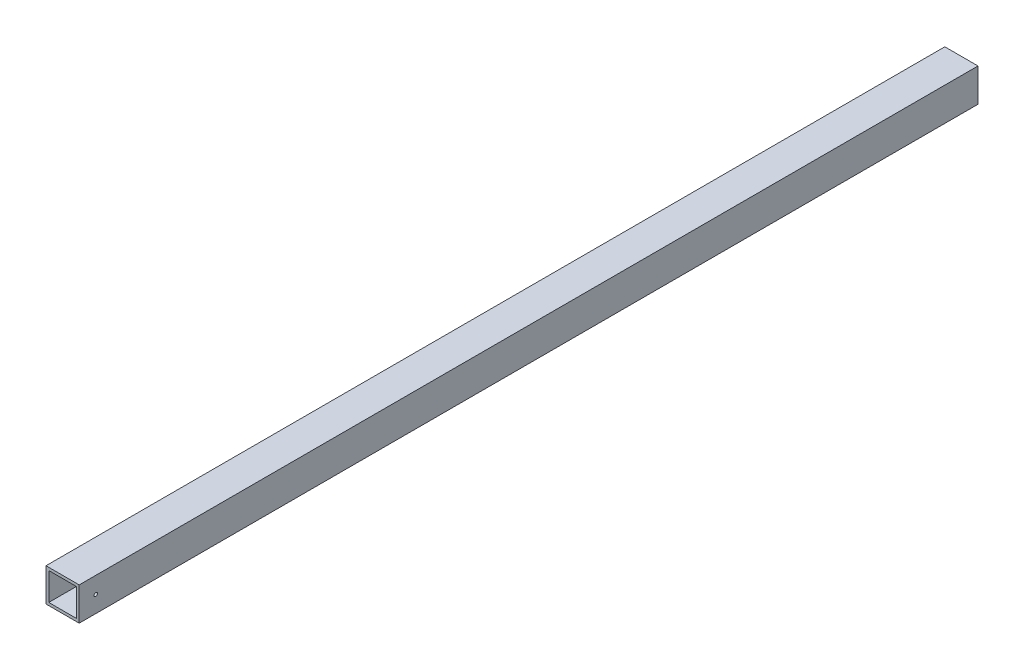
from build123d import *

# Parameters (mm, degrees)
SKETCH_1_W         = 24
SKETCH_1_H         = 24
SKETCH_1_W_2       = 20
SKETCH_1_H_2       = 20
EXTRUDE_1_DEPTH    = 650
HOLE_WIZARD_M3_2_D = 2.5


with BuildPart() as part:
    # 草图1 → 凸台-拉伸1 (new body)
    with BuildSketch(Plane.XY):
        Rectangle(SKETCH_1_W, SKETCH_1_H)
        Rectangle(SKETCH_1_W_2, SKETCH_1_H_2, mode=Mode.SUBTRACT)
    extrude(amount=EXTRUDE_1_DEPTH)

    # M3 螺纹孔的螺纹孔钻头2 (through all)
    with Locations(Plane(origin=(-12, 0, 638), x_dir=(0, -1, 0), z_dir=(-1, 0, 0))):
        with Locations((0, 0)):
            Hole(HOLE_WIZARD_M3_2_D / 2)


solid = part.part
